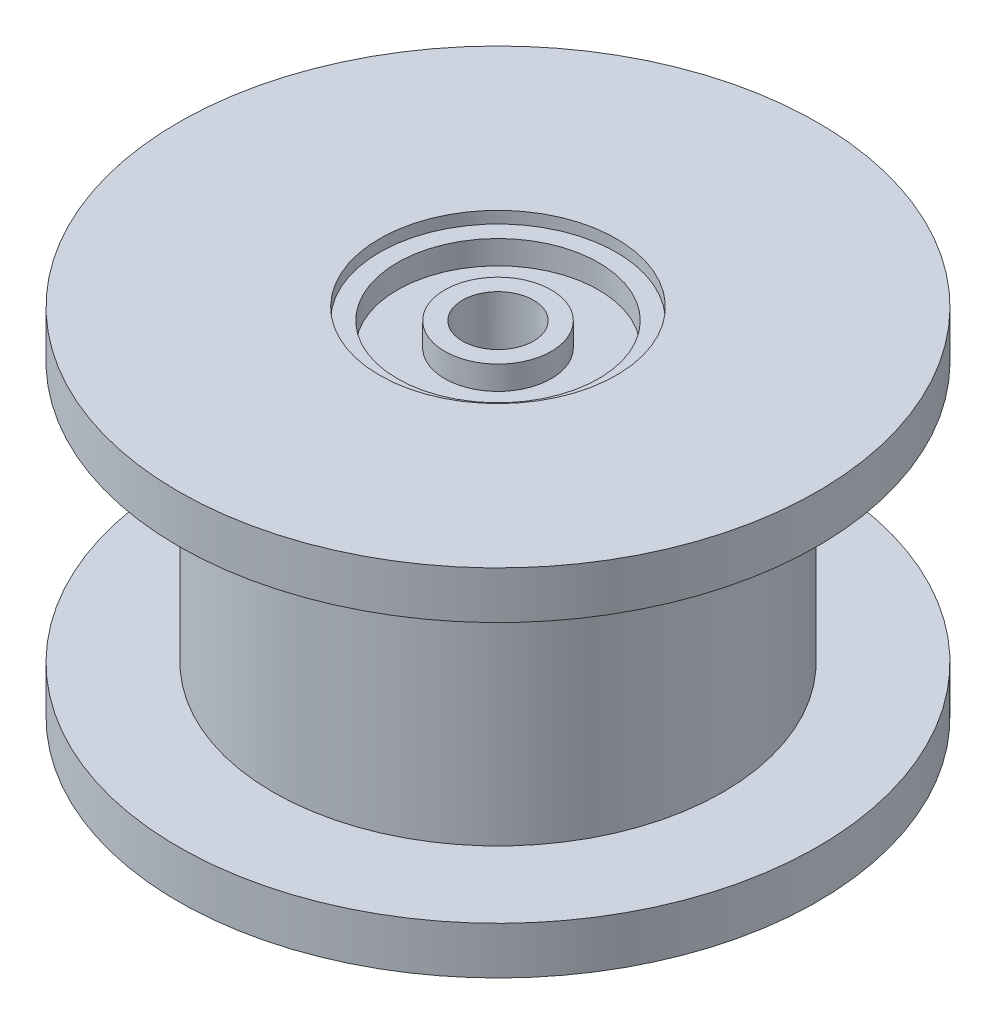
from build123d import *

# Parameters (mm, degrees)
SKETCH_1_R          = 9.5
EXTRUDE_1_DEPTH     = 11
SKETCH_2_R          = 13.5
EXTRUDE_2_DEPTH     = 2
EXTRUDE_START       = 2
SKETCH_3_R          = 13.5
EXTRUDE_3_DEPTH     = 2
SKETCH_4_R          = 5
SKETCH_4_R_2        = 4.25
CUT_EXTRUDE_1_DEPTH = 0.5
SKETCH_4_3_R        = 4.25
SKETCH_4_3_R_2      = 2.25
CUT_EXTRUDE_2_DEPTH = 1.5
SKETCH_4_4_R        = 2.25
SKETCH_4_4_R_2      = 1.5
CUT_EXTRUDE_3_DEPTH = 0.5
SKETCH_4_5_R        = 1.5
CUT_EXTRUDE_4_DEPTH = 25.279621084
CUT_EXTRUDE_START   = -0.5
SKETCH_6_R          = 5
SKETCH_6_R_2        = 4.25
CUT_EXTRUDE_5_DEPTH = 0.5
CUT_EXTRUDE_START_2 = -1.5
SKETCH_6_3_R        = 4.25
SKETCH_6_3_R_2      = 2.25
CUT_EXTRUDE_6_DEPTH = 1.5
SKETCH_6_4_R        = 2.25
SKETCH_6_4_R_2      = 1.5
CUT_EXTRUDE_7_DEPTH = 0.5


with BuildPart() as part:
    # 草图1 → 凸台-拉伸1 (new body)
    with BuildSketch(Plane(origin=(0, 0, 0), x_dir=(1, 0, 0), z_dir=(0, 1, 0))):
        Circle(SKETCH_1_R)
    extrude(amount=EXTRUDE_1_DEPTH)

    # 草图2 → 凸台-拉伸2 (add)
    with BuildSketch(Plane(origin=(0, 11, 0), x_dir=(1, 0, 0), z_dir=(0, 1, 0))):
        Circle(SKETCH_2_R)
    extrude(amount=EXTRUDE_2_DEPTH)

    # 草图3 → 凸台-拉伸3 (add)
    with BuildSketch(Plane.XZ.offset(EXTRUDE_START)):
        Circle(SKETCH_3_R)
    extrude(amount=-EXTRUDE_3_DEPTH)

    # 草图4 → 切除-拉伸1 (cut)
    with BuildSketch(Plane.XZ.offset(2)):
        Circle(SKETCH_4_R)
        Circle(SKETCH_4_R_2, mode=Mode.SUBTRACT)
    extrude(amount=-CUT_EXTRUDE_1_DEPTH, mode=Mode.SUBTRACT)

    # 草图4<3> → 切除-拉伸2 (cut)
    with BuildSketch(Plane.XZ.offset(2)):
        Circle(SKETCH_4_3_R)
        Circle(SKETCH_4_3_R_2, mode=Mode.SUBTRACT)
    extrude(amount=-CUT_EXTRUDE_2_DEPTH, mode=Mode.SUBTRACT)

    # 草图4<4> → 切除-拉伸3 (cut)
    with BuildSketch(Plane.XZ.offset(2)):
        Circle(SKETCH_4_4_R)
        Circle(SKETCH_4_4_R_2, mode=Mode.SUBTRACT)
    extrude(amount=-CUT_EXTRUDE_3_DEPTH, mode=Mode.SUBTRACT)

    # 草图4<5> → 切除-拉伸4 (cut, through all)
    with BuildSketch(Plane.XZ.offset(2)):
        Circle(SKETCH_4_5_R)
    extrude(amount=-CUT_EXTRUDE_4_DEPTH, mode=Mode.SUBTRACT)

    # 草图6 → 切除-拉伸5 (cut)
    with BuildSketch(Plane(origin=(0, 13, 0), x_dir=(1, 0, 0), z_dir=(0, 1, 0)).offset(CUT_EXTRUDE_START)):
        Circle(SKETCH_6_R)
        Circle(SKETCH_6_R_2, mode=Mode.SUBTRACT)
    extrude(amount=CUT_EXTRUDE_5_DEPTH, mode=Mode.SUBTRACT)

    # 草图6<3> → 切除-拉伸6 (cut)
    with BuildSketch(Plane(origin=(0, 13, 0), x_dir=(1, 0, 0), z_dir=(0, 1, 0)).offset(CUT_EXTRUDE_START_2)):
        Circle(SKETCH_6_3_R)
        Circle(SKETCH_6_3_R_2, mode=Mode.SUBTRACT)
    extrude(amount=CUT_EXTRUDE_6_DEPTH, mode=Mode.SUBTRACT)

    # 草图6<4> → 切除-拉伸7 (cut)
    with BuildSketch(Plane(origin=(0, 13, 0), x_dir=(1, 0, 0), z_dir=(0, 1, 0)).offset(CUT_EXTRUDE_START)):
        Circle(SKETCH_6_4_R)
        Circle(SKETCH_6_4_R_2, mode=Mode.SUBTRACT)
    extrude(amount=CUT_EXTRUDE_7_DEPTH, mode=Mode.SUBTRACT)


solid = part.part
